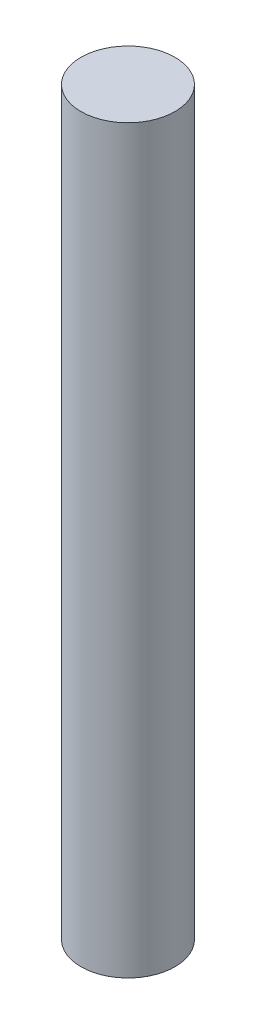
from build123d import *

# Parameters (mm, degrees)
SKETCH2_R           = 3.175
BOSS_EXTRUDE1_DEPTH = 50


with BuildPart() as part:
    # Sketch2 → Boss-Extrude1 (new body)
    with BuildSketch(Plane(origin=(0, 0, 0), x_dir=(1, 0, 0), z_dir=(0, 1, 0))):
        with Locations(Location((0, 0, 0), (0, 0, 270))):
            Circle(SKETCH2_R)
    extrude(amount=BOSS_EXTRUDE1_DEPTH)


solid = part.part
